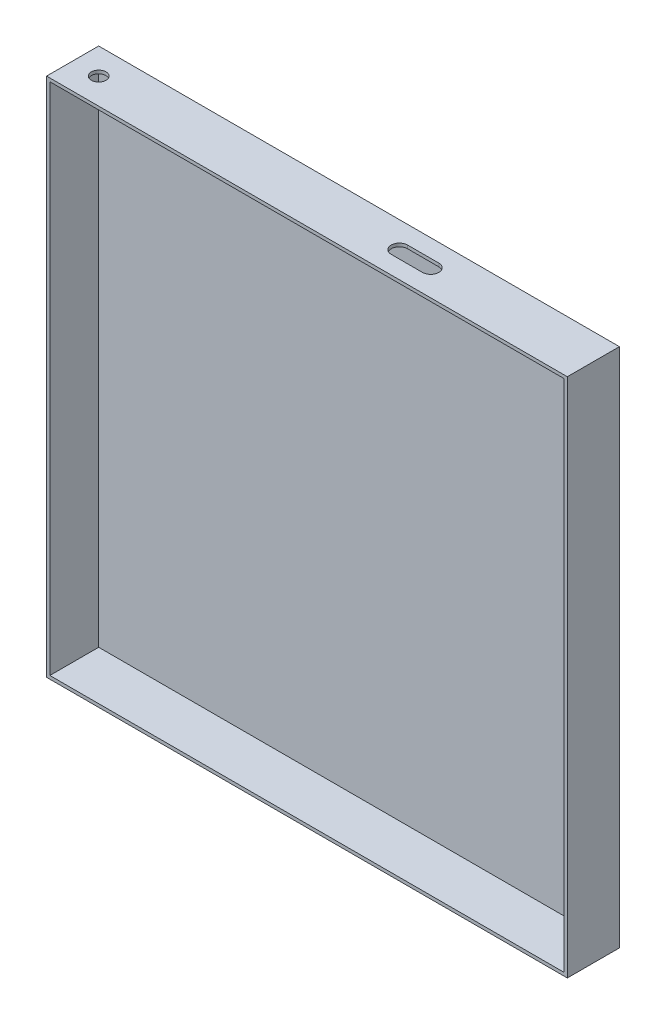
from build123d import *

# Parameters (mm, degrees)
SKETCH1_W           = 508
SKETCH1_H           = 508
BOSS_EXTRUDE1_DEPTH = 50.8
SHELL1_T            = -3.175
SKETCH2_R           = 7.14375
CUT_EXTRUDE1_DEPTH  = 417.576


with BuildPart() as part:
    # Sketch1 → Boss-Extrude1 (new body)
    with BuildSketch(Plane.XY):
        with Locations((254, 254)):
            Rectangle(SKETCH1_W, SKETCH1_H)
    extrude(amount=BOSS_EXTRUDE1_DEPTH)

    # Shell1
    shell1_openings = [part.faces().sort_by_distance(p)[0] for p in [
        (254, 254, 50.8),
    ]]
    offset(amount=SHELL1_T, openings=shell1_openings, kind=Kind.INTERSECTION)

    # Sketch2 → Cut-Extrude1 (cut)
    with BuildSketch(Plane(origin=(0, 508, 0), x_dir=(1, 0, 0), z_dir=(0, 1, 0))):
        with Locations(Location((25.4, -25.4, 0), (0, 0, 270))):
            Circle(SKETCH2_R)
        with BuildLine():
            Line((349.25, -33.3375), (318.77, -33.3375))
            ThreePointArc((318.77, -33.3375), (310.8325, -25.4), (318.77, -17.4625))
            Line((318.77, -17.4625), (349.25, -17.4625))
            ThreePointArc((349.25, -17.4625), (357.1875, -25.4), (349.25, -33.3375))
        make_face()
    extrude(amount=-CUT_EXTRUDE1_DEPTH, mode=Mode.SUBTRACT)


solid = part.part
